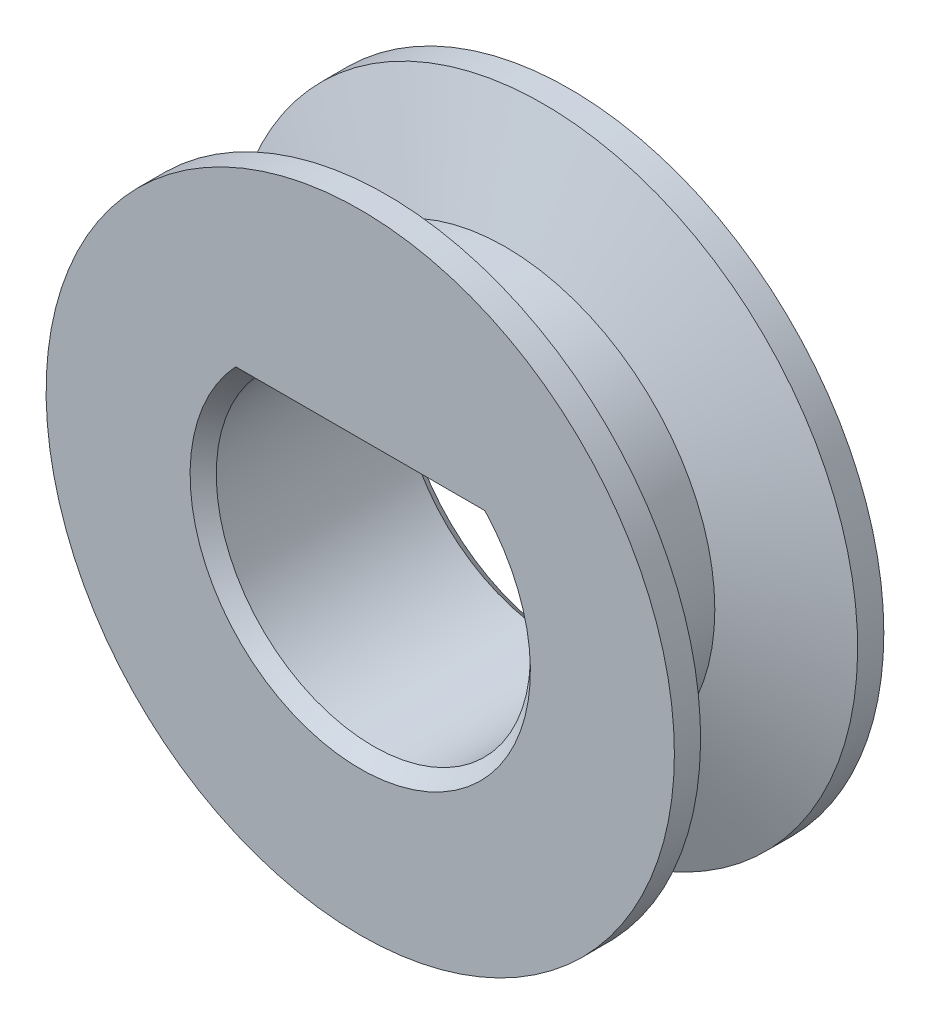
from build123d import *

# Parameters (mm, degrees)
SKETCH1_R           = 19.05
SKETCH1_R_2         = 9.525
EXTRUDE1_DEPTH      = 6.35
CHAMFER1_SIZE       = 0.79375
BOSS_EXTRUDE1_DEPTH = 12.7


with BuildPart() as part:
    # Sketch1 → Extrude1 (new, symmetric)
    with BuildSketch(Plane.XY):
        Circle(SKETCH1_R)
        Circle(SKETCH1_R_2, mode=Mode.SUBTRACT)
    extrude(amount=EXTRUDE1_DEPTH, both=True)

    # Chamfer1
    chamfer1_edges = [part.edges().sort_by_distance(p)[0] for p in [
        (-9.525, 0, -6.35),
        (-9.525, 0, 6.35),
    ]]
    chamfer(chamfer1_edges, length=CHAMFER1_SIZE)

    # Sketch2 → Cut-Revolve1 (revolve, cut)
    with BuildSketch(Plane(origin=(0, 0, 0), x_dir=(0, 0, -1), z_dir=(1, 0, 0)), mode=Mode.PRIVATE) as cut_revolve1_sk:
        Polygon((-4.7625, 19.05), (4.7625, 19.05), (2.451289012, 12.7), (-2.451289012, 12.7), align=None)
    revolve(cut_revolve1_sk.sketch.rotate(Axis((0, 0, 6.35), (0, 0, -1)), 180), axis=Axis((0, 0, 6.35), (0, 0, -1)), mode=Mode.SUBTRACT)

    # Sketch3 → Boss-Extrude1 (add, through all)
    with BuildSketch(Plane(origin=(0, 0, -6.35), x_dir=(-1, 0, 0), z_dir=(0, 0, -1))):
        with BuildLine():
            ThreePointArc((7.558172832, 7.025), (0, 10.31875), (-7.558172832, 7.025))
            Line((-7.558172832, 7.025), (7.558172832, 7.025))
        make_face()
    extrude(amount=-BOSS_EXTRUDE1_DEPTH)


solid = part.part
